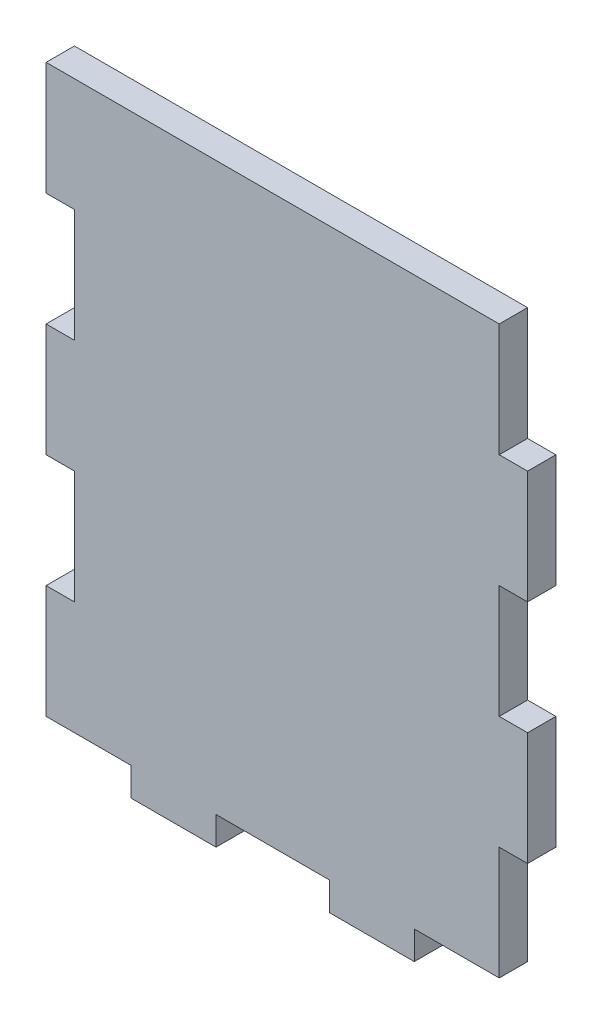
from build123d import *

# Parameters (mm, degrees)
BOXSIDE_DEPTH = 6.35


with BuildPart() as part:
    # Sketch1 → BOXSIDE (new body)
    with BuildSketch(Plane.XY):
        Polygon((-50.8, 38.1), (-50.8, 63.5), (50.8, 63.5), (50.8, 38.1), (57.15, 38.1), (57.15, 12.7), (50.8, 12.7), (50.8, -12.7), (57.15, -12.7), (57.15, -38.1), (50.8, -38.1), (50.8, -63.5), (31.75, -63.5), (31.75, -69.85), (12.7, -69.85), (12.7, -63.5), (-12.7, -63.5), (-12.7, -69.85), (-31.75, -69.85), (-31.75, -63.5), (-50.8, -63.5), (-50.8, -38.1), (-44.45, -38.1), (-44.45, -12.7), (-50.8, -12.7), (-50.8, 12.7), (-44.45, 12.7), (-44.45, 38.1), align=None)
    extrude(amount=BOXSIDE_DEPTH)


solid = part.part
